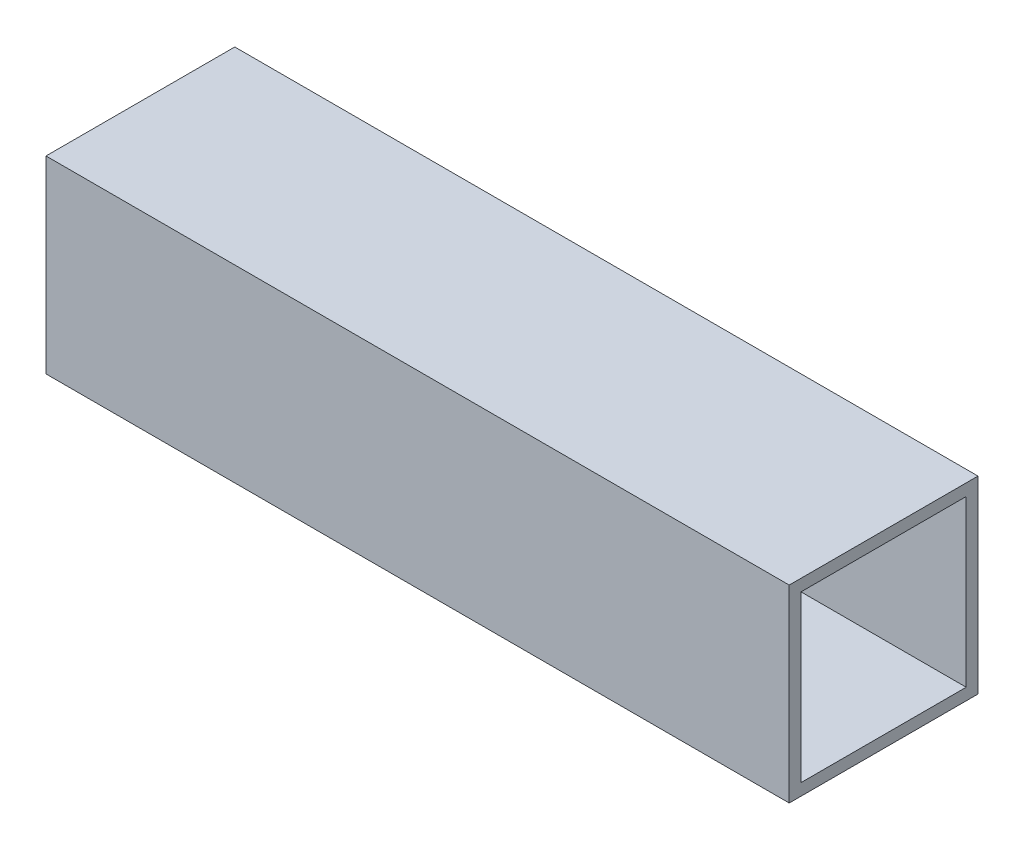
from build123d import *

# Parameters (mm, degrees)
SKETCH1_W           = 25.4
SKETCH1_H           = 25.4
SKETCH1_W_2         = 22.225
SKETCH1_H_2         = 22.225
BOSS_EXTRUDE1_DEPTH = 100


with BuildPart() as part:
    # Sketch1 → Boss-Extrude1 (new body)
    with BuildSketch(Plane(origin=(0, 0, 0), x_dir=(0, 0, -1), z_dir=(1, 0, 0))):
        with Locations((12.7, 12.7)):
            Rectangle(SKETCH1_W, SKETCH1_H)
        with Locations((12.7, 12.7)):
            Rectangle(SKETCH1_W_2, SKETCH1_H_2, mode=Mode.SUBTRACT)
    extrude(amount=BOSS_EXTRUDE1_DEPTH)


solid = part.part
